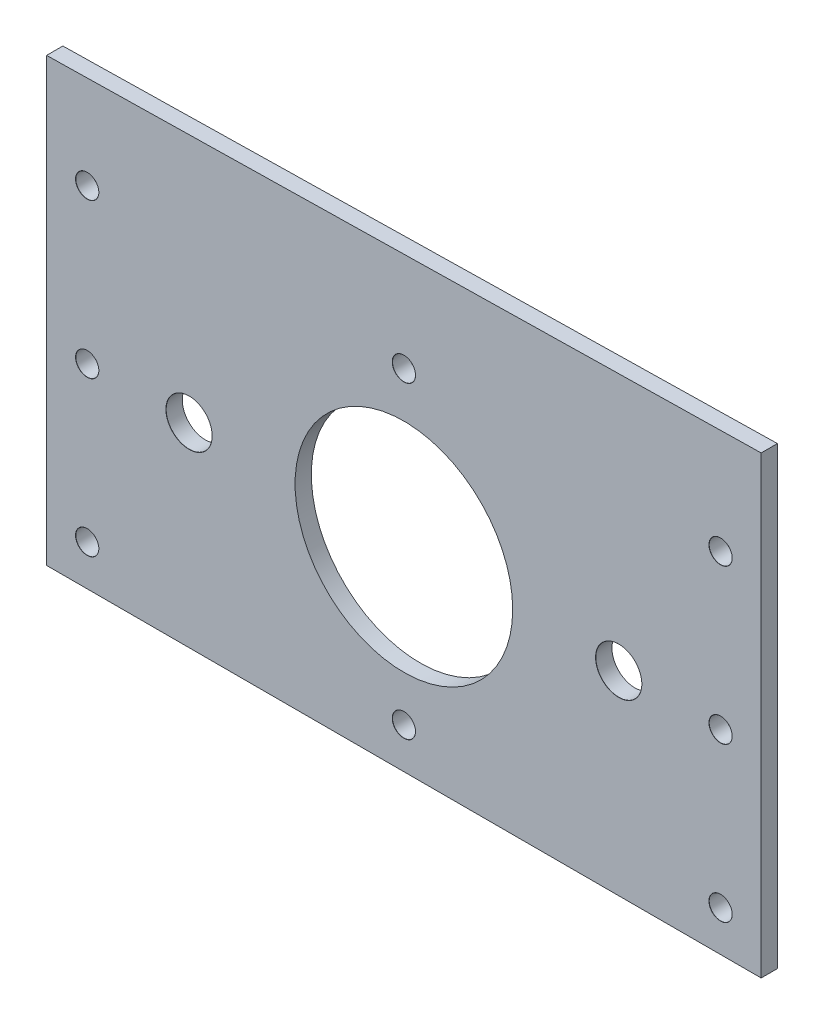
from build123d import *

# Parameters (mm, degrees)
BOSS_EXTRUDE1_DEPTH            = 3.175
M4_CLEARANCE_HOLE1_D           = 4.5
M4_CLEARANCE_HOLE1_CSINK_D     = 4.55
M4_CLEARANCE_HOLE1_CSINK_ANGLE = 90
M8_CLEARANCE_HOLE1_AT_2_COUNT  = 2
M8_CLEARANCE_HOLE1_AT_2_PITCH  = 84
SKETCH9_R                      = 21.275
CENTER_HOLE_DEPTH              = 87.427675689


with BuildPart() as part:
    # Sketch1 → Boss-Extrude1 (new body)
    with BuildSketch(Plane.XY):
        Polygon((-69.85, 48.26), (-69.85, 38.1), (-69.85, -38.1), (69.85, -38.1), (69.85, 38.1), (69.85, 50.8), align=None)
    extrude(amount=BOSS_EXTRUDE1_DEPTH)

    # M4 Clearance Hole1 (through all)
    with Locations(Plane.XY.offset(3.175)):
        with Locations((-61.9125, -30.1625), (0, -30.1625), (61.9125, -30.1625), (61.9125, 30.1625), (61.9125, 0), (0, 30.1625), (-61.9125, 30.1625), (-61.9125, 0)):
            CounterSinkHole(M4_CLEARANCE_HOLE1_D / 2, M4_CLEARANCE_HOLE1_CSINK_D / 2, counter_sink_angle=M4_CLEARANCE_HOLE1_CSINK_ANGLE)

    # Sketch11 → M8 Clearance Hole1 (revolve, cut)
    with BuildSketch(Plane(origin=(-42, 0, 3.175), x_dir=(0, -1, 0), z_dir=(1, 0, 0))):
        Polygon((0, 0), (0, 3.175), (4.5, 3.175), (4.5, 0.025), (4.525, 0), align=None)
    m8_clearance_hole1 = revolve(axis=Axis((-42, 0, 9.525), (0, 0, -1)), mode=Mode.SUBTRACT)

    # M8 Clearance Hole1 at 2: M8 Clearance Hole1 ×2
    with Locations(*[(i * M8_CLEARANCE_HOLE1_AT_2_PITCH, 0, 0) for i in range(1, M8_CLEARANCE_HOLE1_AT_2_COUNT)]):
        add(m8_clearance_hole1, mode=Mode.SUBTRACT)

    # Sketch9 → Center Hole (cut, through all)
    with BuildSketch(Plane.XY.offset(3.175)):
        Circle(SKETCH9_R)
    extrude(amount=-CENTER_HOLE_DEPTH, mode=Mode.SUBTRACT)


solid = part.part
